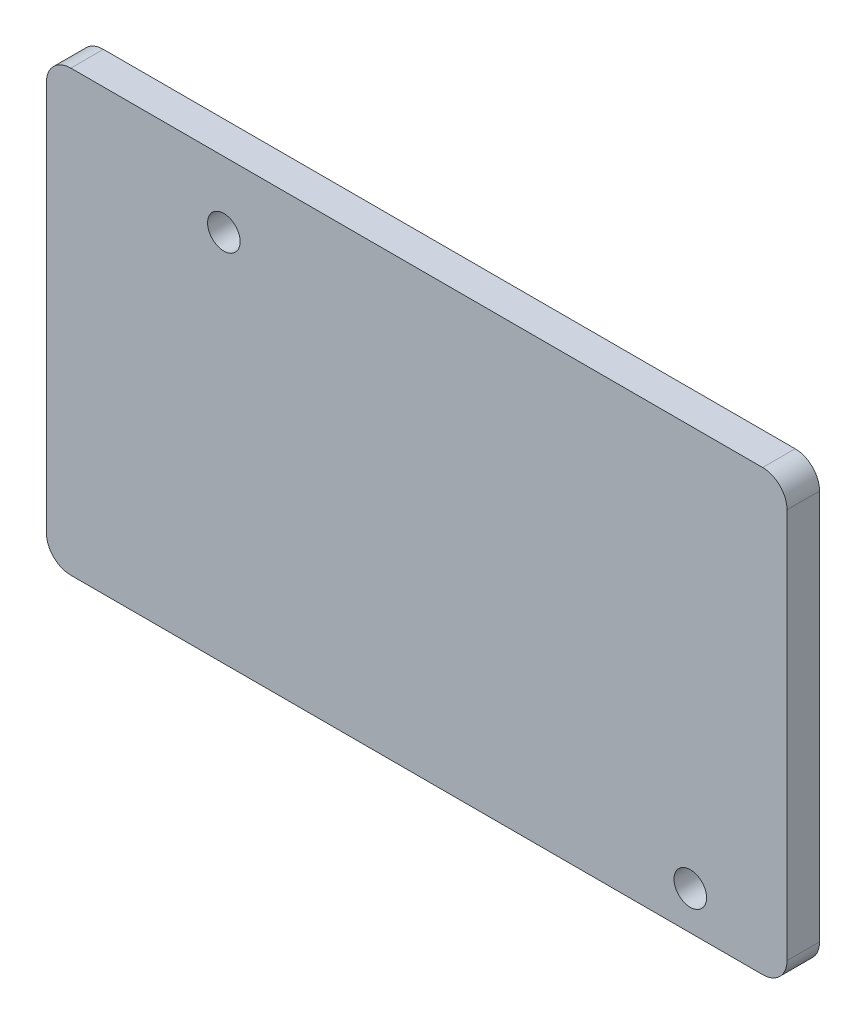
from build123d import *

# Parameters (mm, degrees)
SKETCH1_R           = 1.002175573
BOSS_EXTRUDE1_DEPTH = 2


with BuildPart() as part:
    # Sketch1 → Boss-Extrude1 (new body)
    with BuildSketch(Plane.XY):
        with BuildLine():
            Line((-45.505390048, 11.932639401), (-2.959655608, 11.932639401))
            ThreePointArc((-2.959655608, 11.932639401), (-1.898995436, 12.371979229), (-1.459655608, 13.432639401))
            Line((-1.459655608, 13.432639401), (-1.459655608, 37.443224784))
            ThreePointArc((-1.459655608, 37.443224784), (-1.898995436, 38.503884956), (-2.959655608, 38.943224784))
            Line((-2.959655608, 38.943224784), (-45.505390048, 38.943224784))
            ThreePointArc((-45.505390048, 38.943224784), (-46.56605022, 38.503884956), (-47.005390048, 37.443224784))
            Line((-47.005390048, 37.443224784), (-47.005390048, 13.432639401))
            ThreePointArc((-47.005390048, 13.432639401), (-46.56605022, 12.371979229), (-45.505390048, 11.932639401))
        make_face()
        with Locations((-36.094331879, 34.905234601)):
            Circle(SKETCH1_R, mode=Mode.SUBTRACT)
        with Locations((-7.410237048, 14.298412667)):
            Circle(SKETCH1_R, mode=Mode.SUBTRACT)
    extrude(amount=-BOSS_EXTRUDE1_DEPTH)


solid = part.part
